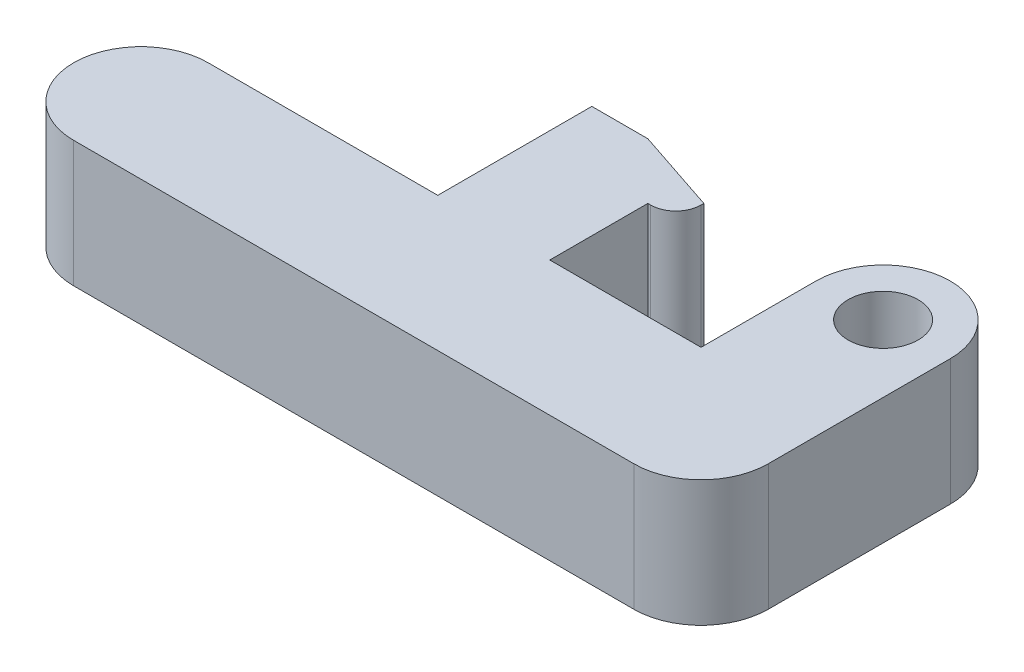
from build123d import *

# Parameters (mm, degrees)
SKETCH1_R           = 1.25
BOSS_EXTRUDE1_DEPTH = 4.5


with BuildPart() as part:
    # Sketch1 → Boss-Extrude1 (new body)
    with BuildSketch(Plane(origin=(0, 0, 0), x_dir=(1, 0, 0), z_dir=(0, 1, 0))):
        with BuildLine():
            Line((2.4, 0), (2.4, -6.5))
            ThreePointArc((2.4, -6.5), (1.697056275, -8.197056275), (0, -8.9))
            Line((0, -8.9), (-20, -8.9))
            ThreePointArc((-20, -8.9), (-22.4, -6.5), (-20, -4.1))
            Line((-20, -4.1), (-11.8, -4.1))
            Line((-11.8, -4.1), (-11.8, 1.4))
            Line((-11.8, 1.4), (-9.8, 1.4))
            Line((-9.8, 1.4), (-6.8, 0.4))
            Line((-6.8, 0.4), (-6.8, 0.3))
            ThreePointArc((-6.8, 0.3), (-7.063603897, -0.336396103), (-7.7, -0.6))
            Line((-7.7, -0.6), (-7.8, -0.6))
            Line((-7.8, -0.6), (-7.8, -4.1))
            Line((-7.8, -4.1), (-2.4, -4.1))
            Line((-2.4, -4.1), (-2.4, 0))
            ThreePointArc((-2.4, 0), (0, 2.4), (2.4, 0))
        make_face()
        with Locations(Location((0, 0, 0), (0, 0, 270))):
            Circle(SKETCH1_R, mode=Mode.SUBTRACT)
    extrude(amount=BOSS_EXTRUDE1_DEPTH)


solid = part.part
